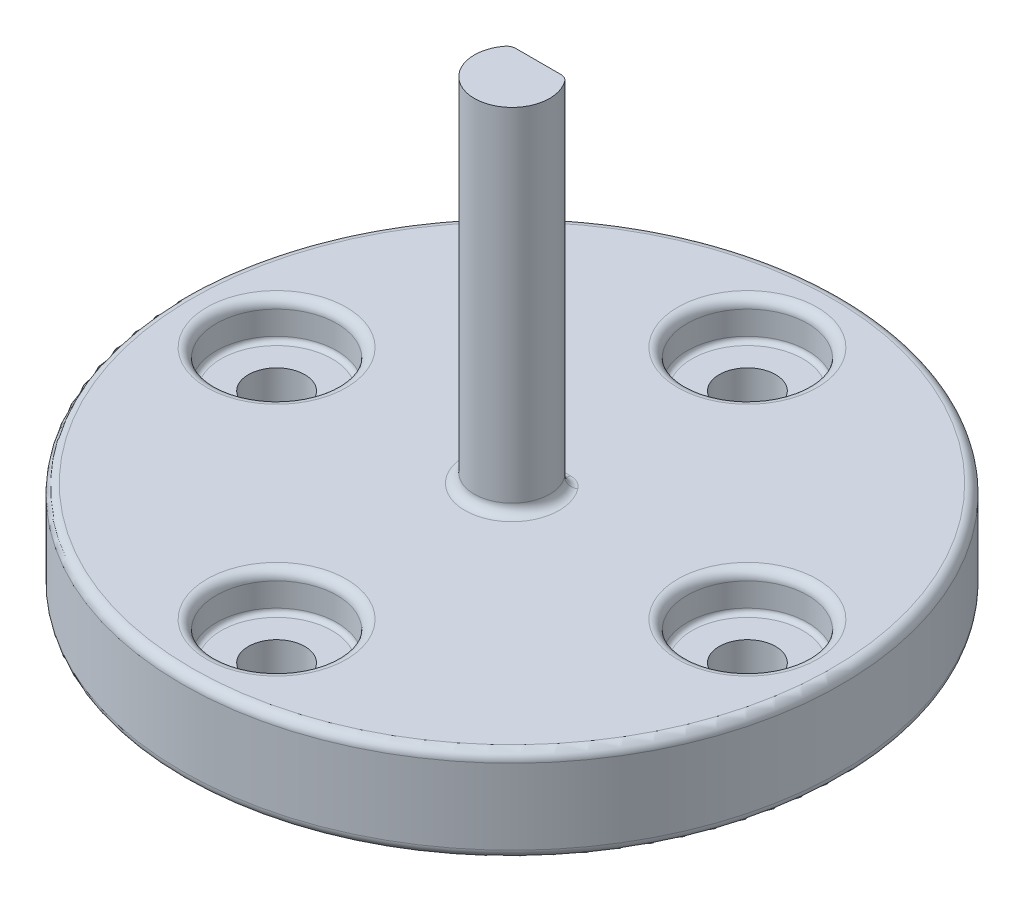
from build123d import *

# Parameters (mm, degrees)
BOSS_EXTRUDE1_DEPTH     = 18.7
FILLET1_R               = 0.5
SKETCH2_R               = 17.5
BOSS_EXTRUDE3_DEPTH     = 5
CUT_EXTRUDE1_DEPTH      = 35.266455901
CUT_EXTRUDE1_DEPTH_BACK = 35.266455901
SKETCH3_R               = 1.5
SKETCH4_R               = 3.2
CUT_EXTRUDE2_DEPTH      = 2
FILLET2_R               = 0.5
FILLET3_R               = 0.25
FILLET4_R               = 0.5
FILLET5_R               = 0.5


with BuildPart() as part:
    # Sketch1 → Boss-Extrude1 (new body)
    with BuildSketch(Plane(origin=(0, 0, 0), x_dir=(1, 0, 0), z_dir=(0, 1, 0))):
        with BuildLine():
            Line((-1.428285686, 1.4), (1.428285686, 1.4))
            ThreePointArc((1.428285686, 1.4), (0, -2), (-1.428285686, 1.4))
        make_face()
    extrude(amount=BOSS_EXTRUDE1_DEPTH)

    # Fillet1
    fillet1_edges = [part.edges().sort_by_distance(p)[0] for p in [
        (-1.428285686, 9.35, -1.4),
        (1.428285686, 9.35, -1.4),
    ]]
    fillet(fillet1_edges, radius=FILLET1_R)

    # Sketch2 → Boss-Extrude3 (add)
    with BuildSketch(Plane(origin=(0, 0, 0), x_dir=(1, 0, 0), z_dir=(0, 1, 0))):
        with Locations(Location((0, 0, 0), (0, 0, 270))):
            Circle(SKETCH2_R)
    extrude(amount=-BOSS_EXTRUDE3_DEPTH)

    # Sketch3 → Cut-Extrude1 (cut, two sides: drawn at the far end of the back side and taken through both)
    with BuildSketch(Plane.XZ.offset(5).offset(-CUT_EXTRUDE1_DEPTH_BACK)):
        with Locations(Location((0, 12.5, 0), (0, 0, 270))):
            Circle(SKETCH3_R)
        with Locations(Location((12.5, 0, 0), (0, 0, 270))):
            Circle(SKETCH3_R)
        with Locations(Location((-12.5, 0, 0), (0, 0, 270))):
            Circle(SKETCH3_R)
        with Locations(Location((0, -12.5, 0), (0, 0, 270))):
            Circle(SKETCH3_R)
    extrude(amount=CUT_EXTRUDE1_DEPTH + CUT_EXTRUDE1_DEPTH_BACK, mode=Mode.SUBTRACT)

    # Sketch4 → Cut-Extrude2 (cut)
    with BuildSketch(Plane(origin=(0, 0, 0), x_dir=(1, 0, 0), z_dir=(0, 1, 0))):
        with Locations(Location((0, -12.5, 0), (0, 0, 270))):
            Circle(SKETCH4_R)
        with Locations(Location((0, 12.5, 0), (0, 0, 270))):
            Circle(SKETCH4_R)
        with Locations(Location((-12.5, 0, 0), (0, 0, 270))):
            Circle(SKETCH4_R)
        with Locations(Location((12.5, 0, 0), (0, 0, 270))):
            Circle(SKETCH4_R)
    extrude(amount=-CUT_EXTRUDE2_DEPTH, mode=Mode.SUBTRACT)

    # Fillet2
    fillet2_edges = [part.edges().sort_by_distance(p)[0] for p in [
        (-12.5, 0, -3.2),
        (12.5, 0, -3.2),
        (0, 0, 9.3),
        (0, 0, -15.7),
    ]]
    fillet(fillet2_edges, radius=FILLET2_R)

    # Fillet3
    fillet3_edges = [part.edges().sort_by_distance(p)[0] for p in [
        (-12.5, -2, -3.2),
        (12.5, -2, -3.2),
        (0, -2, 9.3),
        (0, -2, -15.7),
    ]]
    fillet(fillet3_edges, radius=FILLET3_R)

    # Fillet4
    fillet4_edges = [part.edges().sort_by_distance(p)[0] for p in [
        (0, 0, -17.5),
        (0, -5, -17.5),
    ]]
    fillet(fillet4_edges, radius=FILLET4_R)

    # Fillet5
    fillet5_edges = [part.edges().sort_by_distance(p)[0] for p in [
        (0, 0, 2),
        (-1.423606798, 0, -1.347213595),
        (1.423606798, 0, -1.347213595),
        (0, 0, -1.4),
    ]]
    fillet(fillet5_edges, radius=FILLET5_R)


solid = part.part
